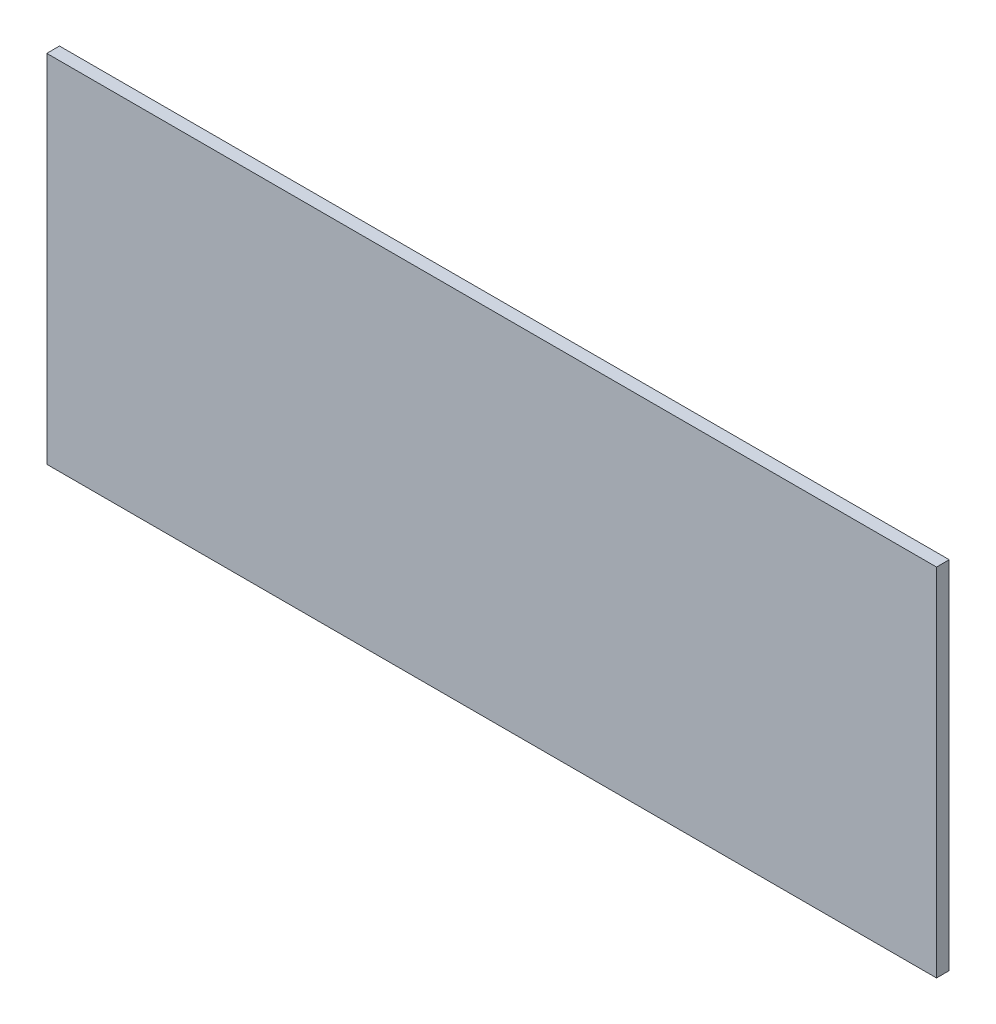
from build123d import *

# Parameters (mm, degrees)
CROQUIS3_W              = 210
CROQUIS3_H              = 84
SALIENTE_EXTRUIR2_DEPTH = 3


with BuildPart() as part:
    # Croquis3 → Saliente-Extruir2 (new body)
    with BuildSketch(Plane.XY):
        with Locations((14.498385096, 42)):
            Rectangle(CROQUIS3_W, CROQUIS3_H)
    extrude(amount=-SALIENTE_EXTRUIR2_DEPTH)


solid = part.part
